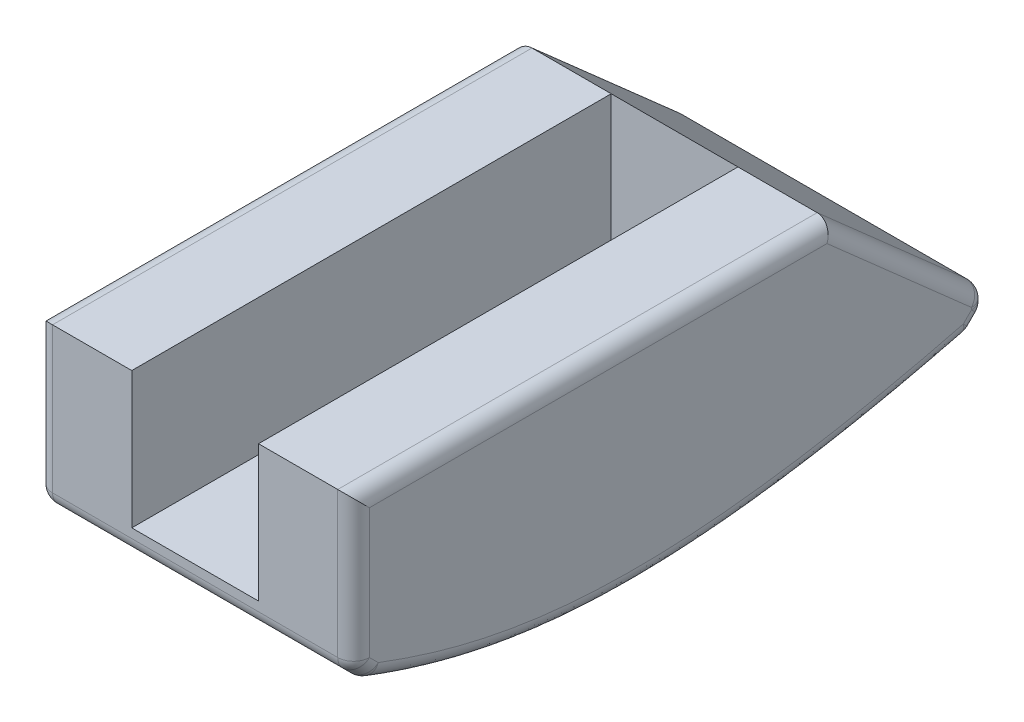
from build123d import *

# Parameters (mm, degrees)
BOSS_EXTRUDE4_DEPTH      = 25
BOSS_EXTRUDE4_DEPTH_BACK = 25
SKETCH4_W                = 20
SKETCH4_H                = 75.64878903
CUT_EXTRUDE1_DEPTH       = 71.37795066
FILLET1_R                = 2.5


with BuildPart() as part:
    # Sketch5 → Boss-Extrude4 (new, two sides: drawn at the far end of the back side and taken through both)
    with BuildSketch(Plane(origin=(0, 0, 0), x_dir=(0, 0, -1), z_dir=(1, 0, 0)).offset(-BOSS_EXTRUDE4_DEPTH_BACK)):
        with BuildLine():
            Line((-37.824394515, 0), (-37.824394515, -2.5))
            Line((-37.824394515, -2.5), (-35.324394515, -5))
            add(Edge.make_bspline(
                [(-35.324394515, -5), (-13.532580845, -13.372844958), (11.79523655, -17.250489512), (59.675605485, -5)],
                knots=[0, 0, 0, 0, 1, 1, 1, 1], degree=3))
            Line((59.675605485, -5), (62.175605485, -2.5))
            Line((62.175605485, -2.5), (62.175605485, 0))
            Line((62.175605485, 0), (37.824394515, 21.5))
            Line((37.824394515, 21.5), (-37.824394515, 21.5))
            Line((-37.824394515, 21.5), (-37.824394515, 0))
        make_face()
    extrude(amount=BOSS_EXTRUDE4_DEPTH + BOSS_EXTRUDE4_DEPTH_BACK)

    # Sketch4 → Cut-Extrude1 (cut, through all)
    with BuildSketch(Plane(origin=(0, 0, 0), x_dir=(1, 0, 0), z_dir=(0, 1, 0))):
        Rectangle(SKETCH4_W, SKETCH4_H)
    extrude(amount=CUT_EXTRUDE1_DEPTH, mode=Mode.SUBTRACT)

    # Fillet1
    fillet1_edges = [part.edges().sort_by_distance(p)[0] for p in [
        (-25, -1.25, -62.175605485),
        (25, -1.25, -62.175605485),
        (0, 0, -62.175605485),
        (-25, -3.75, -60.925605485),
        (25, -3.75, -60.925605485),
        (0, -2.5, -62.175605485),
        (-25, -12.695636992, -12.039484877),
        (12.5, -5, 35.324394515),
        (25, -12.695636992, -12.039484877),
        (12.5, -5, -59.675605485),
        (25, -3.75, 36.574394515),
        (-25, -3.75, 36.574394515),
        (0, -2.5, 37.824394515),
        (25, 9.5, 37.824394515),
        (-25, 9.5, 37.824394515),
        (25, 10.75, -50),
        (-25, 10.75, -50),
        (25, 21.5, 0),
        (-25, 21.5, 0),
    ]]
    fillet(fillet1_edges, radius=FILLET1_R)


solid = part.part
